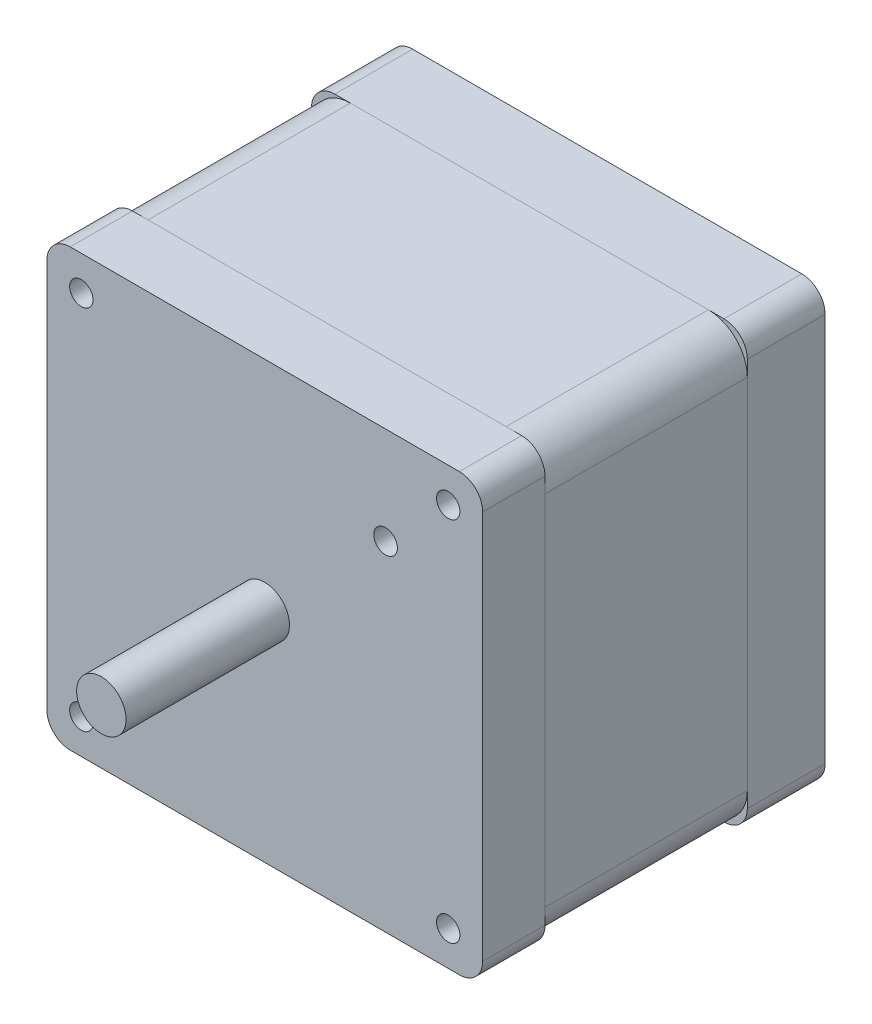
from build123d import *

# Parameters (mm, degrees)
SKETCH_1_R          = 1.5
EXTRUDE_1_DEPTH     = 8
SKETCH_4_R          = 3.175
EXTRUDE_2_DEPTH     = 21
SKETCH_9_W          = 56
SKETCH_9_H          = 56
EXTRUDE_7_DEPTH     = 26
SKETCH_10_W         = 56
SKETCH_10_H         = 56
EXTRUDE_8_DEPTH     = 10
FILLET_1_R          = 3
FILLET_2_R          = 5
SKETCH_12_R         = 1.5
SKETCH_12_R_2       = 1.518540069
CUT_EXTRUDE_1_DEPTH = 60.194594348


with BuildPart() as part:
    # 草图1 → 凸台-拉伸1 (new body)
    with BuildSketch(Plane.XY):
        with BuildLine():
            Line((-25, 28), (25, 28))
            ThreePointArc((25, 28), (27.121320344, 27.121320344), (28, 25))
            Line((28, 25), (28, -25))
            ThreePointArc((28, -25), (27.121320344, -27.121320344), (25, -28))
            Line((25, -28), (-25, -28))
            ThreePointArc((-25, -28), (-27.121320344, -27.121320344), (-28, -25))
            Line((-28, -25), (-28, 25))
            ThreePointArc((-28, 25), (-27.121320344, 27.121320344), (-25, 28))
        make_face()
        with Locations((-23.57, 23.57)):
            Circle(SKETCH_1_R, mode=Mode.SUBTRACT)
        with Locations(Location((23.57, 23.57, 0), (0, 0, 180))):
            Circle(SKETCH_1_R, mode=Mode.SUBTRACT)
        with Locations((23.57, -23.57)):
            Circle(SKETCH_1_R, mode=Mode.SUBTRACT)
        with Locations(Location((-23.57, -23.57, 0), (0, 0, 180))):
            Circle(SKETCH_1_R, mode=Mode.SUBTRACT)
    extrude(amount=EXTRUDE_1_DEPTH)

    # 草图4 → 凸台-拉伸2 (add)
    with BuildSketch(Plane.XY.offset(8)):
        with Locations(Location((0, 0, 0), (0, 0, 180))):
            Circle(SKETCH_4_R)
    extrude(amount=EXTRUDE_2_DEPTH)


with BuildPart() as body_2:
    # 草图9 → 凸台-拉伸7 (new body)
    with BuildSketch(Plane(origin=(0, 0, 0), x_dir=(-1, 0, 0), z_dir=(0, 0, -1))):
        Rectangle(SKETCH_9_W, SKETCH_9_H)
    extrude(amount=EXTRUDE_7_DEPTH)

    # 圆角2
    fillet_2_edges = [body_2.edges().sort_by_distance(p)[0] for p in [
        (-28, -28, -13),
        (28, -28, -13),
        (28, 28, -13),
        (-28, 28, -13),
    ]]
    fillet(fillet_2_edges, radius=FILLET_2_R)


with BuildPart() as body_3:
    # 草图10 → 凸台-拉伸8 (new body)
    with BuildSketch(Plane(origin=(0, 0, -26), x_dir=(-1, 0, 0), z_dir=(0, 0, -1))):
        Rectangle(SKETCH_10_W, SKETCH_10_H)
    extrude(amount=EXTRUDE_8_DEPTH)

    # 圆角1
    fillet_1_edges = [body_3.edges().sort_by_distance(p)[0] for p in [
        (28, 28, -31),
        (-28, 28, -31),
        (-28, -28, -31),
        (28, -28, -31),
    ]]
    fillet(fillet_1_edges, radius=FILLET_1_R)


with BuildPart() as cut_extrude_1_tool:
    # 草图12 → 切除-拉伸1 (new, through all)
    with BuildSketch(Plane.XY.offset(8)):
        with Locations((-23.57, 23.57)):
            Circle(SKETCH_12_R)
        with Locations((15.518540069, 15.5)):
            Circle(SKETCH_12_R_2)
        with Locations((-23.57, -23.57)):
            Circle(SKETCH_12_R)
        with Locations((23.57, -23.57)):
            Circle(SKETCH_12_R)
    extrude(amount=-CUT_EXTRUDE_1_DEPTH)


with BuildPart() as part_1:
    add(part.part)

    # 切除-拉伸1: cut by cut_extrude_1_tool
    add(cut_extrude_1_tool.part, mode=Mode.SUBTRACT)


with BuildPart() as body_2_1:
    add(body_2.part)

    # 切除-拉伸1: cut by cut_extrude_1_tool
    add(cut_extrude_1_tool.part, mode=Mode.SUBTRACT)


with BuildPart() as body_3_1:
    add(body_3.part)

    # 切除-拉伸1: cut by cut_extrude_1_tool
    add(cut_extrude_1_tool.part, mode=Mode.SUBTRACT)


solid = Compound([part_1.part, body_2_1.part, body_3_1.part])
